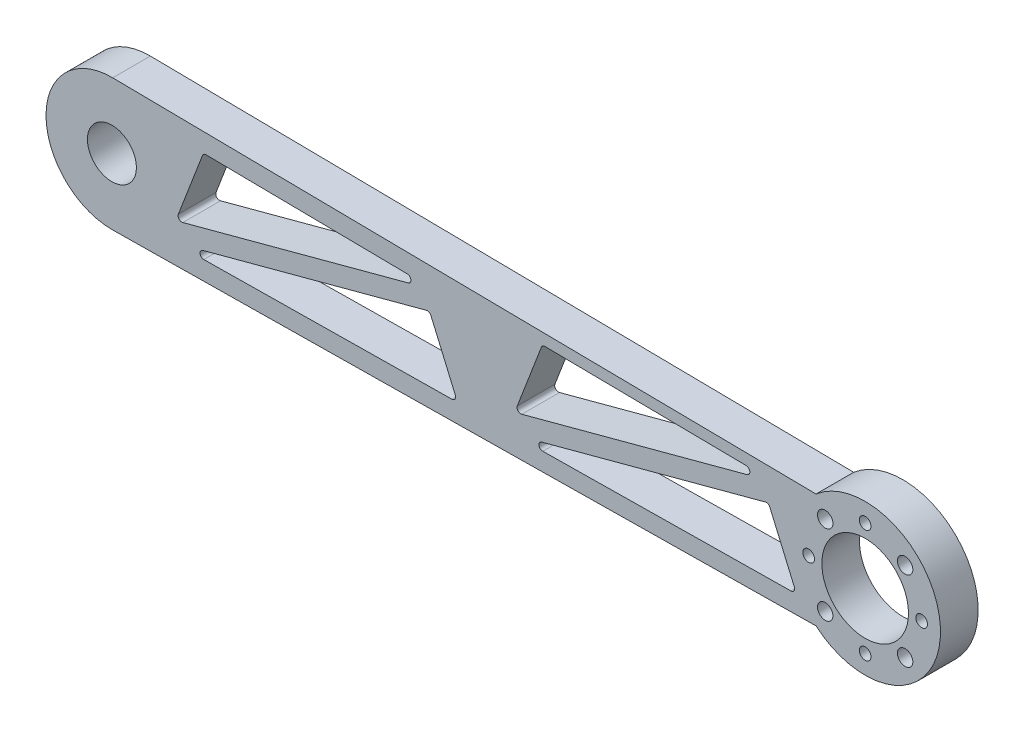
from build123d import *

# Parameters (mm, degrees)
EXTRUDE_1_DEPTH     = 10
SKETCH_2_R          = 6.5
CUT_EXTRUDE_1_DEPTH = 10
CUT_EXTRUDE_2_DEPTH = 10
FILLET_1_R          = 1
EXTRUDE_START       = -10
EXTRUDE_2_DEPTH     = 10
SKETCH_5_R          = 1.55
SKETCH_5_R_2        = 2.05
CUT_EXTRUDE_3_DEPTH = 10
SKETCH_6_R          = 11.5
CUT_EXTRUDE_4_DEPTH = 10


with BuildPart() as part:
    # 草图1 → 凸台-拉伸1 (new body)
    with BuildSketch(Plane.XY):
        with BuildLine():
            Line((200.1875, 14.998828079), (0.21875, 17.498632759))
            ThreePointArc((0.21875, 17.498632759), (-17.5, 0), (0.21875, -17.498632759))
            Line((0.21875, -17.498632759), (200.1875, -14.998828079))
            ThreePointArc((200.1875, -14.998828079), (215, 0), (200.1875, 14.998828079))
        make_face()
    extrude(amount=EXTRUDE_1_DEPTH)

    # 草图2 → 切除-拉伸1 (cut)
    with BuildSketch(Plane.XY.offset(10)):
        Circle(SKETCH_2_R)
    extrude(amount=-CUT_EXTRUDE_1_DEPTH, mode=Mode.SUBTRACT)

    # 草图3 → 切除-拉伸2 (cut)
    with BuildSketch(Plane.XY.offset(10)):
        Polygon((24.289001935, 12.19734043), (85.658139631, 11.430166271), (16.937408094, -6.979422532), align=None)
        Polygon((16.414613885, -12.295777972), (84.346077325, 5.902373893), (91.781134838, -11.353622851), align=None)
        Polygon((106.93275646, -6.06439659), (114.284350301, 13.112366373), (175.653487997, 12.345192214), align=None)
        Polygon((181.776483204, -10.438596909), (106.409962251, -11.380752029), (174.341425691, 6.817399835), align=None)
    extrude(amount=-CUT_EXTRUDE_2_DEPTH, mode=Mode.SUBTRACT)

    # 圆角1
    fillet_1_edges = [part.edges().sort_by_distance(p)[0] for p in [
        (84.346077325, 5.902373893, 5),
        (91.781134838, -11.353622851, 5),
        (16.414613885, -12.295777972, 5),
        (175.653487997, 12.345192214, 5),
        (106.93275646, -6.06439659, 5),
        (114.284350301, 13.112366373, 5),
        (174.341425691, 6.817399835, 5),
        (181.776483204, -10.438596909, 5),
        (106.409962251, -11.380752029, 5),
        (85.658139631, 11.430166271, 5),
        (16.937408094, -6.979422532, 5),
        (24.289001935, 12.19734043, 5),
    ]]
    fillet(fillet_1_edges, radius=FILLET_1_R)

    # 草图4 → 凸台-拉伸2 (add)
    with BuildSketch(Plane.XY.offset(10).offset(EXTRUDE_START)):
        with BuildLine():
            Line((186.959776982, 15.164187536), (200.1875, 14.998828079))
            ThreePointArc((200.1875, 14.998828079), (215, 0), (200.1875, -14.998828079))
            Line((200.1875, -14.998828079), (186.959776982, -15.164187536))
            ThreePointArc((186.959776982, -15.164187536), (220, 0), (186.959776982, 15.164187536))
        make_face()
    extrude(amount=EXTRUDE_2_DEPTH)

    # 草图5 → 切除-拉伸3 (cut)
    with BuildSketch(Plane.XY.offset(10)):
        with Locations((200, 15)):
            Circle(SKETCH_5_R)
        with Locations((215, 0)):
            Circle(SKETCH_5_R)
        with Locations((200, -15)):
            Circle(SKETCH_5_R)
        with Locations((185, 0)):
            Circle(SKETCH_5_R)
        with Locations((189.393398282, 10.606601718)):
            Circle(SKETCH_5_R_2)
        with Locations((210.606601718, 10.606601718)):
            Circle(SKETCH_5_R_2)
        with Locations((210.606601718, -10.606601718)):
            Circle(SKETCH_5_R_2)
        with Locations((189.393398282, -10.606601718)):
            Circle(SKETCH_5_R_2)
    extrude(amount=-CUT_EXTRUDE_3_DEPTH, mode=Mode.SUBTRACT)

    # 草图6 → 切除-拉伸4 (cut)
    with BuildSketch(Plane.XY.offset(10)):
        with Locations((200, 0)):
            Circle(SKETCH_6_R)
    extrude(amount=-CUT_EXTRUDE_4_DEPTH, mode=Mode.SUBTRACT)


solid = part.part
